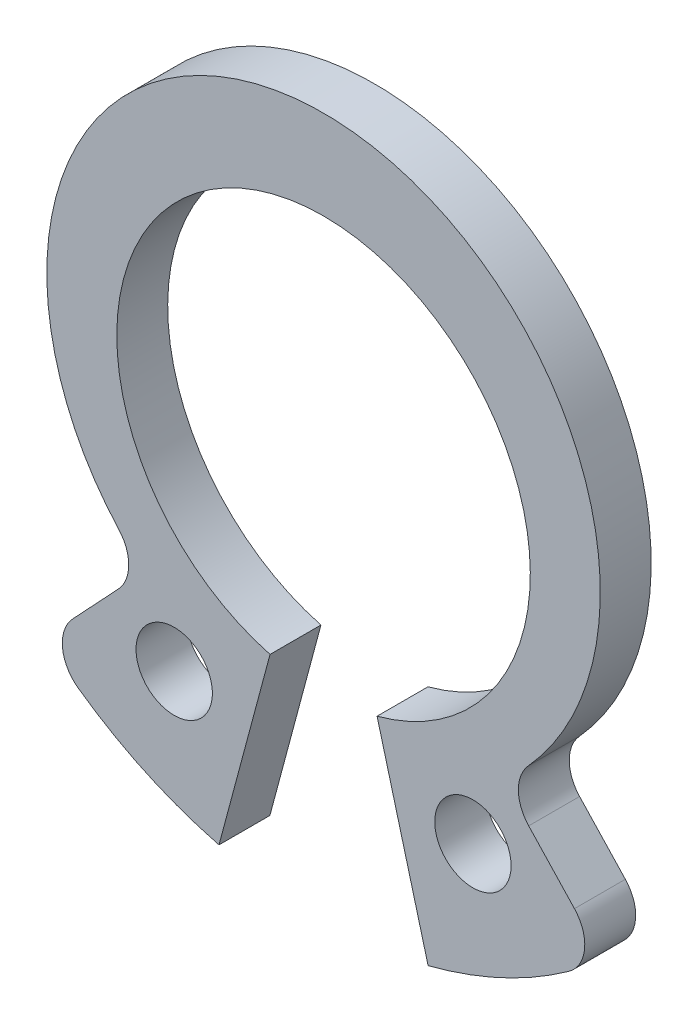
from build123d import *

# Parameters (mm, degrees)
ESQUISSE1_R          = 0.6
BASE_EXTRUSION_DEPTH = 0.8


with BuildPart() as part:
    # Esquisse1 → Base-Extrusion (new body)
    with BuildSketch(Plane.XY):
        with BuildLine():
            Line((3.22454123, -3.44045674), (3.944011448, -4.208102734))
            ThreePointArc((3.944011448, -4.208102734), (4.10328113, -4.677848996), (3.854520727, -5.106972107))
            ThreePointArc((3.854520727, -5.106972107), (2.796527605, -5.722633208), (1.643500936, -6.133628997))
            Line((1.643500936, -6.133628997), (0.841161897, -3.139258935))
            ThreePointArc((0.841161897, -3.139258935), (0, 3.25), (-0.841161897, -3.139258935))
            Line((-0.841161897, -3.139258935), (-1.643500936, -6.133628997))
            ThreePointArc((-1.643500936, -6.133628997), (-2.796527605, -5.722633208), (-3.854520727, -5.106972107))
            ThreePointArc((-3.854520727, -5.106972107), (-4.10328113, -4.677848996), (-3.944011448, -4.208102734))
            Line((-3.944011448, -4.208102734), (-3.22454123, -3.44045674))
            ThreePointArc((-3.22454123, -3.44045674), (-3.062336925, -3.034677238), (-3.218402302, -2.62649733))
            ThreePointArc((-3.218402302, -2.62649733), (0, 4.65), (3.218402302, -2.62649733))
            ThreePointArc((3.218402302, -2.62649733), (3.062336925, -3.034677238), (3.22454123, -3.44045674))
        make_face()
        with Locations((2.347841312, -4.123115521)):
            Circle(ESQUISSE1_R, mode=Mode.SUBTRACT)
        with Locations(Location((-2.347841312, -4.123115521, 0), (0, 0, 180))):
            Circle(ESQUISSE1_R, mode=Mode.SUBTRACT)
    extrude(amount=BASE_EXTRUSION_DEPTH)


solid = part.part
